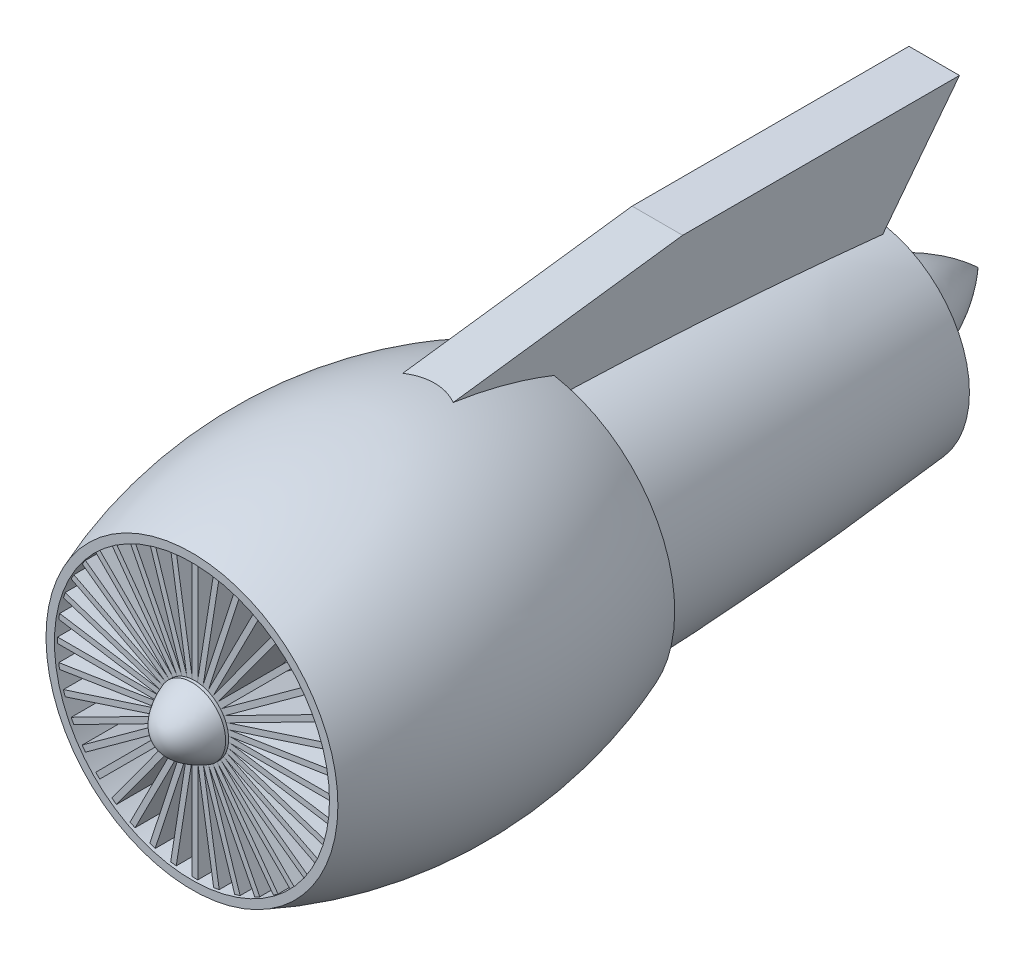
from build123d import *

# Parameters (mm, degrees)
SKETCH3_R           = 1244.6
SKETCH3_R_2         = 304.8
CUT_EXTRUDE1_DEPTH  = 609.6
SKETCH4_R           = 914.4
SKETCH4_R_2         = 469.9
CUT_EXTRUDE4_DEPTH  = 914.4
BOSS_EXTRUDE1_DEPTH = 228.6
SKETCH6_W           = 50.8
SKETCH6_H           = 1244.340789334
BOSS_EXTRUDE4_DEPTH = 582.422
CIRPATTERN2_COUNT   = 40


with BuildPart() as part:
    # Sketch2 → Revolve3 (revolve)
    with BuildSketch(Plane(origin=(0, 0, 0), x_dir=(0, 0, -1), z_dir=(1, 0, 0)), mode=Mode.PRIVATE) as revolve3_sk:
        with BuildLine():
            Line((304.8, 304.8), (304.8, 0))
            Line((304.8, 0), (3352.8, 0))
            Line((3352.8, 0), (3352.8, 1143))
            Line((3352.8, 1143), (3352.8, 1320.8))
            ThreePointArc((3352.8, 1320.8), (1828.8, 1606.55), (304.8, 1320.8))
            Line((304.8, 1320.8), (304.8, 304.8))
        make_face()
        with BuildLine():
            Line((3352.8, 1143), (3352.8, 0))
            Line((3352.8, 0), (6400.8, 0))
            Line((6400.8, 0), (6400.8, 469.9))
            Line((6400.8, 469.9), (6400.8, 939.8))
            ThreePointArc((6400.8, 939.8), (4878.600301347, 1068.404520211), (3352.8, 1143))
        make_face()
        with BuildLine():
            Line((6400.8, 469.9), (6400.8, 0))
            Line((6400.8, 0), (7418.07, 0))
            ThreePointArc((7418.07, 0), (6946.680053514, 315.580507742), (6400.8, 469.9))
        make_face()
        with BuildLine():
            Line((0, 0), (304.8, 0))
            Line((304.8, 0), (304.8, 304.8))
            add(Edge.make_bspline(
                [(304.8, 304.8), (224.009103508, 277.163356264), (0, 180.44527442), (0, 0)],
                knots=[0, 0, 0, 0, 1, 1, 1, 1], degree=3))
        make_face()
    revolve(revolve3_sk.sketch.rotate(Axis((0, 0, 0), (0, 0, -1)), 90), axis=Axis((0, 0, 0), (0, 0, -1)))

    # Sketch3 → Cut-Extrude1 (cut)
    with BuildSketch(Plane.XY.offset(-304.8)):
        Circle(SKETCH3_R)
        Circle(SKETCH3_R_2, mode=Mode.SUBTRACT)
    extrude(amount=-CUT_EXTRUDE1_DEPTH, mode=Mode.SUBTRACT)

    # Sketch4 → Cut-Extrude4 (cut)
    with BuildSketch(Plane(origin=(0, 0, -6400.8), x_dir=(-1, 0, 0), z_dir=(0, 0, -1))):
        Circle(SKETCH4_R)
        Circle(SKETCH4_R_2, mode=Mode.SUBTRACT)
    extrude(amount=-CUT_EXTRUDE4_DEPTH, mode=Mode.SUBTRACT)

    # Sketch5 → Boss-Extrude1 (add, symmetric)
    with BuildSketch(Plane(origin=(0, 0, 0), x_dir=(0, 0, -1), z_dir=(1, 0, 0))):
        Polygon((1777.504561589, 1457.746683388), (4516.637881844, 1817.10648415), (7021.945530017, 1817.10648415), (6300.038764697, 883.296737965), (3352.8, 1032.701557372), align=None)
    extrude(amount=BOSS_EXTRUDE1_DEPTH, both=True)


with BuildPart() as body_2:
    # Sketch6 → Boss-Extrude4 (new body)
    with BuildSketch(Plane.XY.offset(-914.4)):
        with Locations((0, 622.170394667)):
            Rectangle(SKETCH6_W, SKETCH6_H)
    extrude(amount=BOSS_EXTRUDE4_DEPTH)


with BuildPart() as cirpattern2_1:
    # CirPattern2: pattern copy
    add(body_2.part.rotate(Axis((0, 0, 0), (0, 0, 1)), 1 * 360 / CIRPATTERN2_COUNT))


with BuildPart() as cirpattern2_2:
    # CirPattern2: pattern copy
    add(body_2.part.rotate(Axis((0, 0, 0), (0, 0, 1)), 2 * 360 / CIRPATTERN2_COUNT))


with BuildPart() as cirpattern2_3:
    # CirPattern2: pattern copy
    add(body_2.part.rotate(Axis((0, 0, 0), (0, 0, 1)), 3 * 360 / CIRPATTERN2_COUNT))


with BuildPart() as cirpattern2_4:
    # CirPattern2: pattern copy
    add(body_2.part.rotate(Axis((0, 0, 0), (0, 0, 1)), 4 * 360 / CIRPATTERN2_COUNT))


with BuildPart() as cirpattern2_5:
    # CirPattern2: pattern copy
    add(body_2.part.rotate(Axis((0, 0, 0), (0, 0, 1)), 5 * 360 / CIRPATTERN2_COUNT))


with BuildPart() as cirpattern2_6:
    # CirPattern2: pattern copy
    add(body_2.part.rotate(Axis((0, 0, 0), (0, 0, 1)), 6 * 360 / CIRPATTERN2_COUNT))


with BuildPart() as cirpattern2_7:
    # CirPattern2: pattern copy
    add(body_2.part.rotate(Axis((0, 0, 0), (0, 0, 1)), 7 * 360 / CIRPATTERN2_COUNT))


with BuildPart() as cirpattern2_8:
    # CirPattern2: pattern copy
    add(body_2.part.rotate(Axis((0, 0, 0), (0, 0, 1)), 8 * 360 / CIRPATTERN2_COUNT))


with BuildPart() as cirpattern2_9:
    # CirPattern2: pattern copy
    add(body_2.part.rotate(Axis((0, 0, 0), (0, 0, 1)), 9 * 360 / CIRPATTERN2_COUNT))


with BuildPart() as cirpattern2_10:
    # CirPattern2: pattern copy
    add(body_2.part.rotate(Axis((0, 0, 0), (0, 0, 1)), 10 * 360 / CIRPATTERN2_COUNT))


with BuildPart() as cirpattern2_11:
    # CirPattern2: pattern copy
    add(body_2.part.rotate(Axis((0, 0, 0), (0, 0, 1)), 11 * 360 / CIRPATTERN2_COUNT))


with BuildPart() as cirpattern2_12:
    # CirPattern2: pattern copy
    add(body_2.part.rotate(Axis((0, 0, 0), (0, 0, 1)), 12 * 360 / CIRPATTERN2_COUNT))


with BuildPart() as cirpattern2_13:
    # CirPattern2: pattern copy
    add(body_2.part.rotate(Axis((0, 0, 0), (0, 0, 1)), 13 * 360 / CIRPATTERN2_COUNT))


with BuildPart() as cirpattern2_14:
    # CirPattern2: pattern copy
    add(body_2.part.rotate(Axis((0, 0, 0), (0, 0, 1)), 14 * 360 / CIRPATTERN2_COUNT))


with BuildPart() as cirpattern2_15:
    # CirPattern2: pattern copy
    add(body_2.part.rotate(Axis((0, 0, 0), (0, 0, 1)), 15 * 360 / CIRPATTERN2_COUNT))


with BuildPart() as cirpattern2_16:
    # CirPattern2: pattern copy
    add(body_2.part.rotate(Axis((0, 0, 0), (0, 0, 1)), 16 * 360 / CIRPATTERN2_COUNT))


with BuildPart() as cirpattern2_17:
    # CirPattern2: pattern copy
    add(body_2.part.rotate(Axis((0, 0, 0), (0, 0, 1)), 17 * 360 / CIRPATTERN2_COUNT))


with BuildPart() as cirpattern2_18:
    # CirPattern2: pattern copy
    add(body_2.part.rotate(Axis((0, 0, 0), (0, 0, 1)), 18 * 360 / CIRPATTERN2_COUNT))


with BuildPart() as cirpattern2_19:
    # CirPattern2: pattern copy
    add(body_2.part.rotate(Axis((0, 0, 0), (0, 0, 1)), 19 * 360 / CIRPATTERN2_COUNT))


with BuildPart() as cirpattern2_20:
    # CirPattern2: pattern copy
    add(body_2.part.rotate(Axis((0, 0, 0), (0, 0, 1)), 20 * 360 / CIRPATTERN2_COUNT))


with BuildPart() as cirpattern2_21:
    # CirPattern2: pattern copy
    add(body_2.part.rotate(Axis((0, 0, 0), (0, 0, 1)), 21 * 360 / CIRPATTERN2_COUNT))


with BuildPart() as cirpattern2_22:
    # CirPattern2: pattern copy
    add(body_2.part.rotate(Axis((0, 0, 0), (0, 0, 1)), 22 * 360 / CIRPATTERN2_COUNT))


with BuildPart() as cirpattern2_23:
    # CirPattern2: pattern copy
    add(body_2.part.rotate(Axis((0, 0, 0), (0, 0, 1)), 23 * 360 / CIRPATTERN2_COUNT))


with BuildPart() as cirpattern2_24:
    # CirPattern2: pattern copy
    add(body_2.part.rotate(Axis((0, 0, 0), (0, 0, 1)), 24 * 360 / CIRPATTERN2_COUNT))


with BuildPart() as cirpattern2_25:
    # CirPattern2: pattern copy
    add(body_2.part.rotate(Axis((0, 0, 0), (0, 0, 1)), 25 * 360 / CIRPATTERN2_COUNT))


with BuildPart() as cirpattern2_26:
    # CirPattern2: pattern copy
    add(body_2.part.rotate(Axis((0, 0, 0), (0, 0, 1)), 26 * 360 / CIRPATTERN2_COUNT))


with BuildPart() as cirpattern2_27:
    # CirPattern2: pattern copy
    add(body_2.part.rotate(Axis((0, 0, 0), (0, 0, 1)), 27 * 360 / CIRPATTERN2_COUNT))


with BuildPart() as cirpattern2_28:
    # CirPattern2: pattern copy
    add(body_2.part.rotate(Axis((0, 0, 0), (0, 0, 1)), 28 * 360 / CIRPATTERN2_COUNT))


with BuildPart() as cirpattern2_29:
    # CirPattern2: pattern copy
    add(body_2.part.rotate(Axis((0, 0, 0), (0, 0, 1)), 29 * 360 / CIRPATTERN2_COUNT))


with BuildPart() as cirpattern2_30:
    # CirPattern2: pattern copy
    add(body_2.part.rotate(Axis((0, 0, 0), (0, 0, 1)), 30 * 360 / CIRPATTERN2_COUNT))


with BuildPart() as cirpattern2_31:
    # CirPattern2: pattern copy
    add(body_2.part.rotate(Axis((0, 0, 0), (0, 0, 1)), 31 * 360 / CIRPATTERN2_COUNT))


with BuildPart() as cirpattern2_32:
    # CirPattern2: pattern copy
    add(body_2.part.rotate(Axis((0, 0, 0), (0, 0, 1)), 32 * 360 / CIRPATTERN2_COUNT))


with BuildPart() as cirpattern2_33:
    # CirPattern2: pattern copy
    add(body_2.part.rotate(Axis((0, 0, 0), (0, 0, 1)), 33 * 360 / CIRPATTERN2_COUNT))


with BuildPart() as cirpattern2_34:
    # CirPattern2: pattern copy
    add(body_2.part.rotate(Axis((0, 0, 0), (0, 0, 1)), 34 * 360 / CIRPATTERN2_COUNT))


with BuildPart() as cirpattern2_35:
    # CirPattern2: pattern copy
    add(body_2.part.rotate(Axis((0, 0, 0), (0, 0, 1)), 35 * 360 / CIRPATTERN2_COUNT))


with BuildPart() as cirpattern2_36:
    # CirPattern2: pattern copy
    add(body_2.part.rotate(Axis((0, 0, 0), (0, 0, 1)), 36 * 360 / CIRPATTERN2_COUNT))


with BuildPart() as cirpattern2_37:
    # CirPattern2: pattern copy
    add(body_2.part.rotate(Axis((0, 0, 0), (0, 0, 1)), 37 * 360 / CIRPATTERN2_COUNT))


with BuildPart() as cirpattern2_38:
    # CirPattern2: pattern copy
    add(body_2.part.rotate(Axis((0, 0, 0), (0, 0, 1)), 38 * 360 / CIRPATTERN2_COUNT))


with BuildPart() as cirpattern2_39:
    # CirPattern2: pattern copy
    add(body_2.part.rotate(Axis((0, 0, 0), (0, 0, 1)), 39 * 360 / CIRPATTERN2_COUNT))


solid = Compound([part.part, body_2.part, cirpattern2_1.part, cirpattern2_2.part, cirpattern2_3.part, cirpattern2_4.part, cirpattern2_5.part, cirpattern2_6.part, cirpattern2_7.part, cirpattern2_8.part, cirpattern2_9.part, cirpattern2_10.part, cirpattern2_11.part, cirpattern2_12.part, cirpattern2_13.part, cirpattern2_14.part, cirpattern2_15.part, cirpattern2_16.part, cirpattern2_17.part, cirpattern2_18.part, cirpattern2_19.part, cirpattern2_20.part, cirpattern2_21.part, cirpattern2_22.part, cirpattern2_23.part, cirpattern2_24.part, cirpattern2_25.part, cirpattern2_26.part, cirpattern2_27.part, cirpattern2_28.part, cirpattern2_29.part, cirpattern2_30.part, cirpattern2_31.part, cirpattern2_32.part, cirpattern2_33.part, cirpattern2_34.part, cirpattern2_35.part, cirpattern2_36.part, cirpattern2_37.part, cirpattern2_38.part, cirpattern2_39.part])
